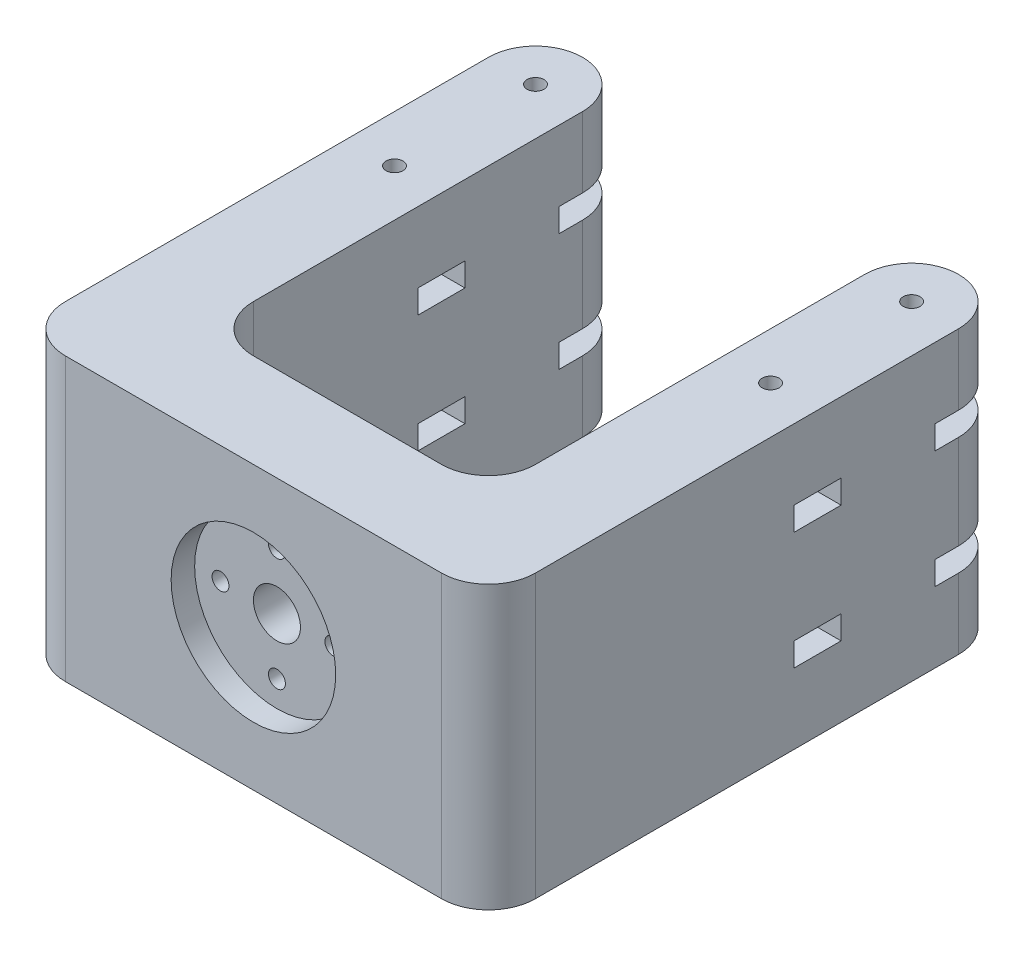
from build123d import *

# Parameters (mm, degrees)
BOSS_EXTRUDE1_DEPTH     = 30
FILLET1_R               = 10
CUT_EXTRUDE1_DEPTH      = 125.49899598
CUT_EXTRUDE1_DEPTH_BACK = 125.49899598
SKETCH3_R               = 5
SKETCH4_R               = 17.5
CUT_EXTRUDE2_DEPTH      = 5
SKETCH5_R               = 1.8
CUT_EXTRUDE3_DEPTH      = 5
CIRPATTERN1_COUNT       = 4
SKETCH6_R               = 1.8
CUT_EXTRUDE4_DEPTH      = 135.907375632
SKETCH7_W               = 20
SKETCH7_H               = 10
CUT_EXTRUDE5_DEPTH      = 5
MIRROR2_COPY_1_SKETCH_W = 20
MIRROR2_COPY_1_SKETCH_H = 10
MIRROR2_COPY_1_DEPTH    = 5


with BuildPart() as part:
    # Sketch1 → Boss-Extrude1 (new, symmetric)
    with BuildSketch(Plane(origin=(0, 0, 0), x_dir=(1, 0, 0), z_dir=(0, 1, 0))):
        with BuildLine():
            Line((-50, 0), (50, 0))
            Line((50, 0), (50, 100))
            ThreePointArc((50, 100), (40, 110), (30, 100))
            Line((30, 100), (30, 20))
            Line((30, 20), (-30, 20))
            Line((-30, 20), (-30, 100))
            ThreePointArc((-30, 100), (-40, 110), (-50, 100))
            Line((-50, 100), (-50, 0))
        make_face()
    extrude(amount=BOSS_EXTRUDE1_DEPTH, both=True)

    # Fillet1
    fillet1_edges = [part.edges().sort_by_distance(p)[0] for p in [
        (50, 0, 0),
        (-50, 0, 0),
        (-30, 0, -20),
        (30, 0, -20),
    ]]
    fillet(fillet1_edges, radius=FILLET1_R)

    # Sketch3 → Cut-Extrude1 (cut, two sides: drawn at the far end of the back side and taken through both)
    with BuildSketch(Plane.XY.offset(-CUT_EXTRUDE1_DEPTH_BACK)):
        Circle(SKETCH3_R)
    extrude(amount=CUT_EXTRUDE1_DEPTH + CUT_EXTRUDE1_DEPTH_BACK, mode=Mode.SUBTRACT)

    # Sketch4 → Cut-Extrude2 (cut)
    with BuildSketch(Plane.XY):
        Circle(SKETCH4_R)
    extrude(amount=-CUT_EXTRUDE2_DEPTH, mode=Mode.SUBTRACT)

    # Sketch5 → Cut-Extrude3 (cut)
    with BuildSketch(Plane.XY.offset(-5)):
        with Locations((0, -12)):
            Circle(SKETCH5_R)
    cut_extrude3 = extrude(amount=-CUT_EXTRUDE3_DEPTH, mode=Mode.SUBTRACT)

    # CirPattern1: Cut-Extrude3 ×4 about axis
    cirpattern1_axis = Axis((0, 0, 0), (0, 0, 1))
    for i in range(1, CIRPATTERN1_COUNT):
        add(cut_extrude3.rotate(cirpattern1_axis, i * 360 / CIRPATTERN1_COUNT), mode=Mode.SUBTRACT)

    # Sketch6 → Cut-Extrude4 (cut, through all)
    with BuildSketch(Plane(origin=(0, 30, 0), x_dir=(1, 0, 0), z_dir=(0, 1, 0))):
        with Locations(Location((-40, 100, 0), (0, 0, 270))):
            Circle(SKETCH6_R)
        with Locations(Location((-40, 70, 0), (0, 0, 270))):
            Circle(SKETCH6_R)
    cut_extrude4 = extrude(amount=-CUT_EXTRUDE4_DEPTH, mode=Mode.SUBTRACT)

    # Sketch7 → Cut-Extrude5 (cut)
    with BuildSketch(Plane(origin=(0, 15, 0), x_dir=(1, 0, 0), z_dir=(0, 1, 0))):
        with BuildLine():
            Line((-50, 105), (-50, 95))
            Line((-50, 95), (-30, 95))
            Line((-30, 95), (-30, 105))
            ThreePointArc((-30, 105), (-40, 115), (-50, 105))
        make_face()
        with Locations((-40, 70)):
            Rectangle(SKETCH7_W, SKETCH7_H)
    cut_extrude5 = extrude(amount=-CUT_EXTRUDE5_DEPTH, mode=Mode.SUBTRACT)

    # Mirror1: Cut-Extrude5 across plane
    add(cut_extrude5.mirror(Plane.ZX), mode=Mode.SUBTRACT)

    # Mirror2: Cut-Extrude4, Cut-Extrude5 across plane
    add(cut_extrude4.mirror(Plane(origin=(0, 0, 0), x_dir=(0, 0, 1), z_dir=(1, 0, 0))), mode=Mode.SUBTRACT)
    add(cut_extrude5.mirror(Plane(origin=(0, 0, 0), x_dir=(0, 0, 1), z_dir=(1, 0, 0))), mode=Mode.SUBTRACT)

    # Mirror2 copy 1 sketch → Mirror2 copy 1 (cut)
    with BuildSketch(Plane(origin=(0, -15, 0), x_dir=(-1, 0, 0), z_dir=(0, -1, 0))):
        with BuildLine():
            Line((-50, 105), (-50, 95))
            Line((-50, 95), (-30, 95))
            Line((-30, 95), (-30, 105))
            ThreePointArc((-30, 105), (-40, 115), (-50, 105))
        make_face()
        with Locations((-40, 70)):
            Rectangle(MIRROR2_COPY_1_SKETCH_W, MIRROR2_COPY_1_SKETCH_H)
    extrude(amount=-MIRROR2_COPY_1_DEPTH, mode=Mode.SUBTRACT)


solid = part.part
